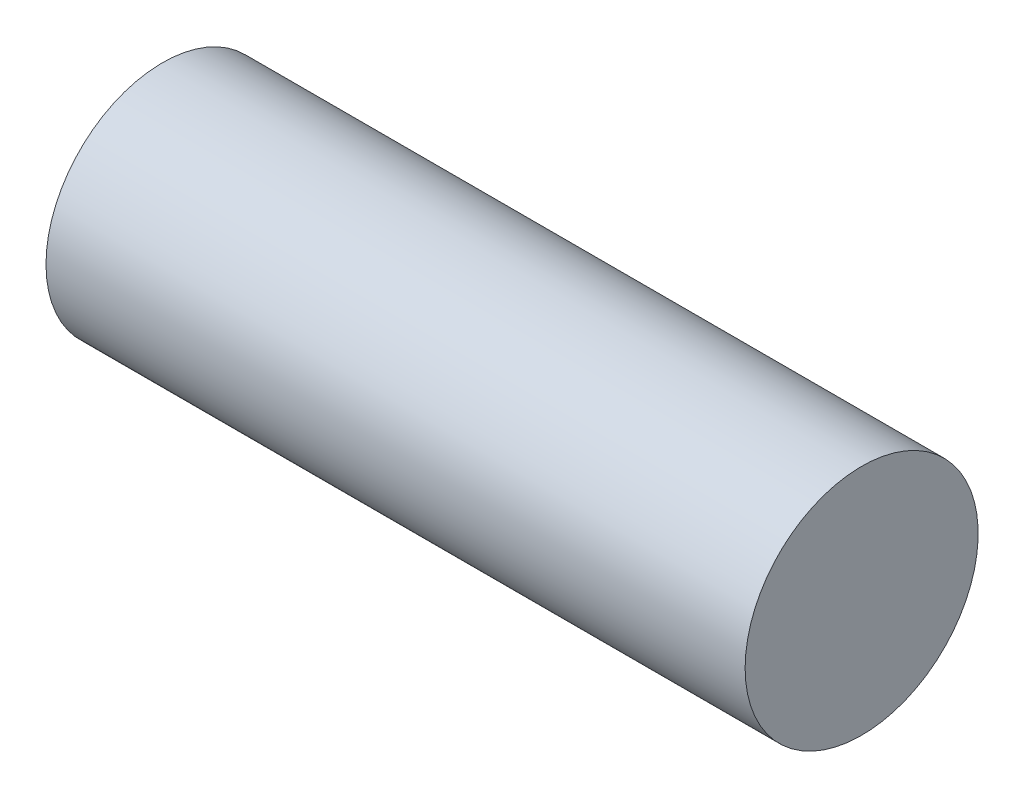
from build123d import *

# Parameters (mm, degrees)
SKETCH1_W = 30
SKETCH1_H = 5


with BuildPart() as part:
    # Sketch1 → Revolve1 (revolve)
    with BuildSketch(Plane.XY, mode=Mode.PRIVATE) as revolve1_sk:
        with Locations((4.719734912, 5.151515152)):
            Rectangle(SKETCH1_W, SKETCH1_H)
    revolve(revolve1_sk.sketch.rotate(Axis((-10.280265088, 7.651515152, 0), (1, 0, 0)), 270), axis=Axis((-10.280265088, 7.651515152, 0), (1, 0, 0)))


solid = part.part
